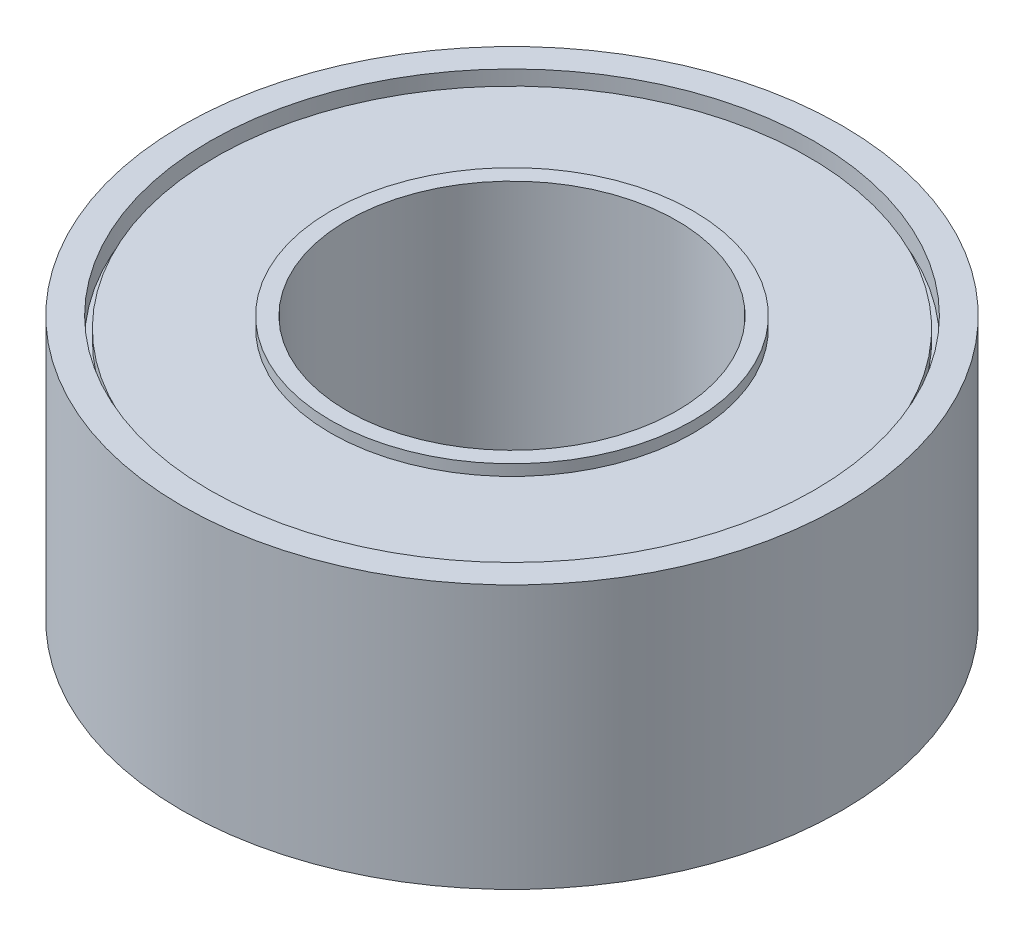
from build123d import *

# Parameters (mm, degrees)
SKETCH_1_R          = 3
SKETCH_1_R_2        = 1.5
EXTRUDE_1_DEPTH     = 2.4
SKETCH_2_R          = 2.75
SKETCH_2_R_2        = 1.65
CUT_EXTRUDE_1_DEPTH = 0.1
CUT_EXTRUDE_START   = -0.1
SKETCH_3_R          = 2.75
SKETCH_3_R_2        = 1.65
CUT_EXTRUDE_2_DEPTH = 0.1
SKETCH_4_R          = 2.75
SKETCH_4_R_2        = 2.7
CUT_EXTRUDE_3_DEPTH = 0.1
SKETCH_5_R          = 2.75
SKETCH_5_R_2        = 2.7
CUT_EXTRUDE_4_DEPTH = 0.1


with BuildPart() as part:
    # 草图1 → 凸台-拉伸1 (new body)
    with BuildSketch(Plane(origin=(0, 0, 0), x_dir=(1, 0, 0), z_dir=(0, 1, 0))):
        with Locations(Location((0, 0, 0), (0, 0, 270))):
            Circle(SKETCH_1_R)
        with Locations(Location((0, 0, 0), (0, 0, 270))):
            Circle(SKETCH_1_R_2, mode=Mode.SUBTRACT)
    extrude(amount=EXTRUDE_1_DEPTH)

    # 草图2 → 切除-拉伸1 (cut)
    with BuildSketch(Plane(origin=(0, 2.4, 0), x_dir=(1, 0, 0), z_dir=(0, 1, 0))):
        with Locations(Location((0, 0, 0), (0, 0, 270))):
            Circle(SKETCH_2_R)
        with Locations(Location((0, 0, 0), (0, 0, 270))):
            Circle(SKETCH_2_R_2, mode=Mode.SUBTRACT)
    extrude(amount=-CUT_EXTRUDE_1_DEPTH, mode=Mode.SUBTRACT)

    # 草图3 → 切除-拉伸2 (cut)
    with BuildSketch(Plane.XZ.offset(CUT_EXTRUDE_START)):
        with Locations(Location((0, 0, 0), (0, 0, 90))):
            Circle(SKETCH_3_R)
        with Locations(Location((0, 0, 0), (0, 0, 90))):
            Circle(SKETCH_3_R_2, mode=Mode.SUBTRACT)
    extrude(amount=CUT_EXTRUDE_2_DEPTH, mode=Mode.SUBTRACT)

    # 草图4 → 切除-拉伸3 (cut)
    with BuildSketch(Plane.XZ.offset(-0.1).offset(CUT_EXTRUDE_START)):
        with Locations(Location((0, 0, 0), (0, 0, 90))):
            Circle(SKETCH_4_R)
        with Locations(Location((0, 0, 0), (0, 0, 270))):
            Circle(SKETCH_4_R_2, mode=Mode.SUBTRACT)
    extrude(amount=CUT_EXTRUDE_3_DEPTH, mode=Mode.SUBTRACT)

    # 草图5 → 切除-拉伸4 (cut)
    with BuildSketch(Plane(origin=(0, 2.3, 0), x_dir=(1, 0, 0), z_dir=(0, 1, 0))):
        with Locations(Location((0, 0, 0), (0, 0, 270))):
            Circle(SKETCH_5_R)
        with Locations(Location((0, 0, 0), (0, 0, 90))):
            Circle(SKETCH_5_R_2, mode=Mode.SUBTRACT)
    extrude(amount=-CUT_EXTRUDE_4_DEPTH, mode=Mode.SUBTRACT)


solid = part.part
